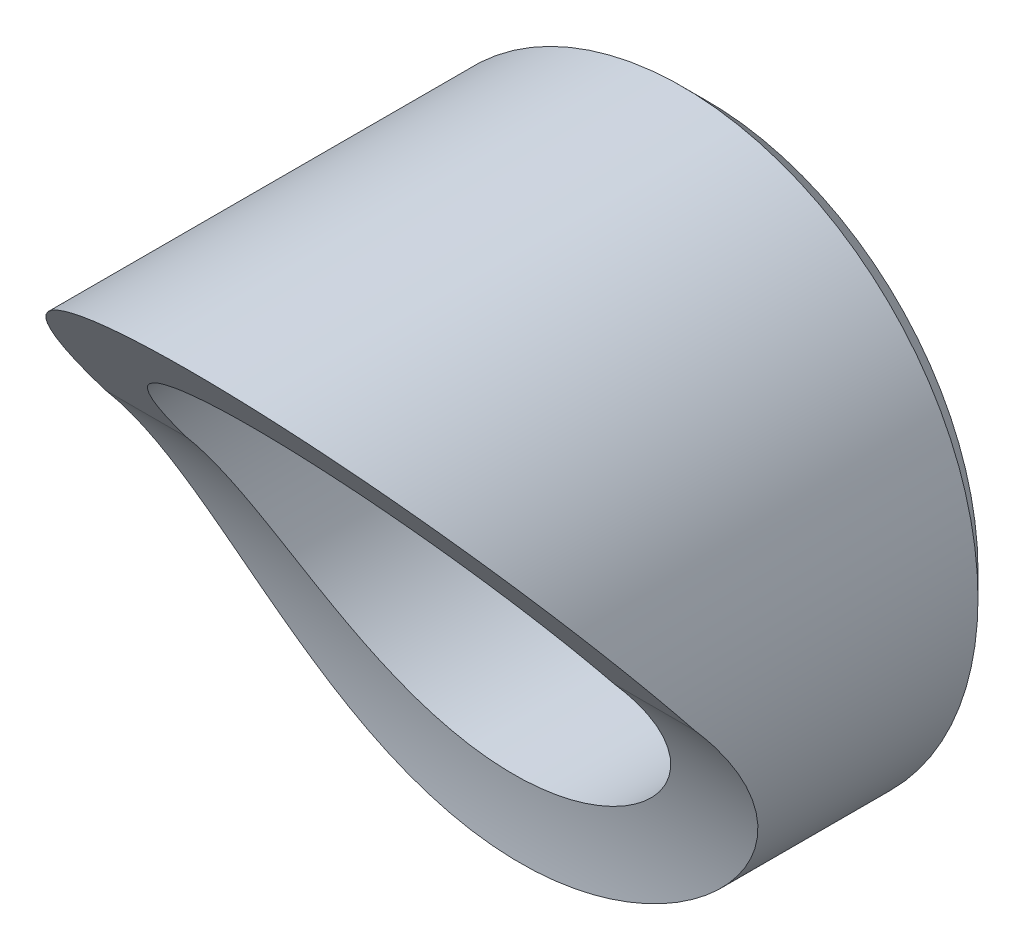
from build123d import *

# Parameters (mm, degrees)
SKETCH_1_R               = 12
EXTRUDE_1_DEPTH          = 21
CUT_EXTRUDE_1_DEPTH      = 21
CUT_EXTRUDE_1_DEPTH_BACK = 21
HOLE_WIZARD_M20_2_D      = 17.5
CHAMFER_2_SIZE           = 1


with BuildPart() as part:
    # 草图1 → 凸台-拉伸1 (new body)
    with BuildSketch(Plane.XY):
        Circle(SKETCH_1_R)
    extrude(amount=EXTRUDE_1_DEPTH)

    # 草图2 → 切除-拉伸1 (cut, two sides: drawn at the far end of the back side and taken through both)
    with BuildSketch(Plane(origin=(0, 0, 0), x_dir=(0, 0, -1), z_dir=(1, 0, 0)).offset(-CUT_EXTRUDE_1_DEPTH_BACK)):
        with BuildLine():
            Line((-21, 12), (-12.451705037, 1.058681393))
            ThreePointArc((-12.451705037, 1.058681393), (-8.852121463, -5.034581824), (-7.6, -12))
            Line((-7.6, -12), (-21, -12))
            Line((-21, -12), (-21, 12))
        make_face()
    extrude(amount=CUT_EXTRUDE_1_DEPTH + CUT_EXTRUDE_1_DEPTH_BACK, mode=Mode.SUBTRACT)

    # M20 螺纹孔2 (through all)
    with Locations(Plane(origin=(0, 0, 0), x_dir=(-1, 0, 0), z_dir=(0, 0, -1))):
        with Locations((0, 0)):
            Hole(HOLE_WIZARD_M20_2_D / 2)

    # 倒角2
    chamfer_2_edges = [part.edges().sort_by_distance(p)[0] for p in [
        (-12, 0, 0),
    ]]
    chamfer(chamfer_2_edges, length=CHAMFER_2_SIZE)


solid = part.part
